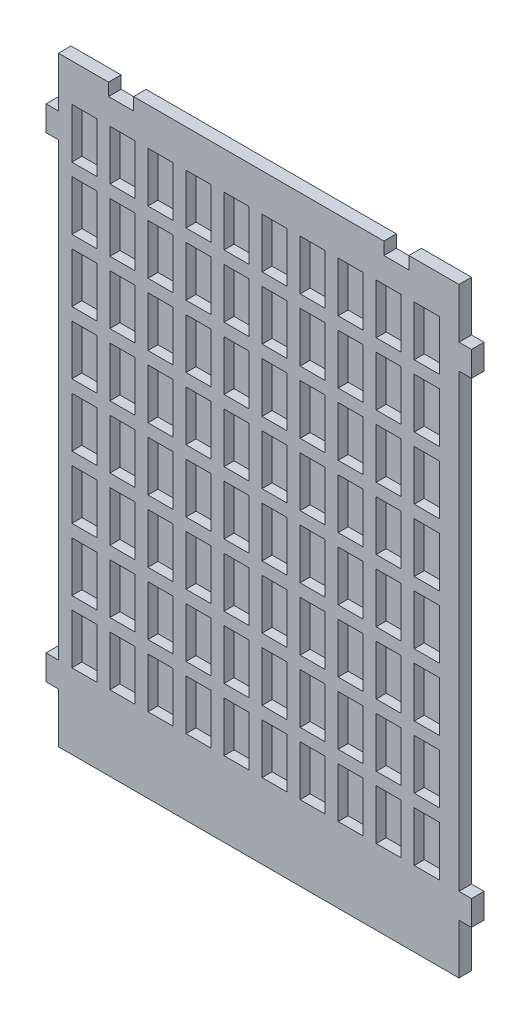
from build123d import *

# Parameters (mm, degrees)
BOSS_EXTRUDE1_DEPTH  = 3.175
SKETCH2_W            = 6.35
SKETCH2_H            = 12.7
CUT_EXTRUDE1_DEPTH   = 2.54
LPATTERN1_COUNT      = 10
LPATTERN1_PITCH      = 9.652
LPATTERN1_COUNT_DIR2 = 8
LPATTERN1_PITCH_DIR2 = 15.875


with BuildPart() as part:
    # Sketch1 → Boss-Extrude1 (new body)
    with BuildSketch(Plane.XY):
        Polygon((82.55, 0), (19.05, 0), (19.05, -3.175), (12.7, -3.175), (12.7, 0), (0, 0), (0, -12.7), (-3.175, -12.7), (-3.175, -19.05), (0, -19.05), (0, -133.35), (-3.175, -133.35), (-3.175, -139.7), (0, -139.7), (0, -152.4), (12.7, -152.4), (88.9, -152.4), (101.6, -152.4), (101.6, -139.7), (104.775, -139.7), (104.775, -133.35), (101.6, -133.35), (101.6, -19.05), (104.775, -19.05), (104.775, -12.7), (101.6, -12.7), (101.6, 0), (88.9, 0), (88.9, -3.175), (82.55, -3.175), align=None)
    extrude(amount=BOSS_EXTRUDE1_DEPTH)

    # Sketch2 → Cut-Extrude1 (cut)
    with BuildSketch(Plane.XY.offset(3.175)):
        with Locations((6.559374439, -15.875)):
            Rectangle(SKETCH2_W, SKETCH2_H)
    cut_extrude1 = extrude(amount=-CUT_EXTRUDE1_DEPTH, mode=Mode.SUBTRACT)

    # LPattern1: Cut-Extrude1 10 × 8
    with Locations(*[(i * LPATTERN1_PITCH, -j * LPATTERN1_PITCH_DIR2, 0) for i in range(LPATTERN1_COUNT) for j in range(LPATTERN1_COUNT_DIR2) if (i, j) != (0, 0)]):
        add(cut_extrude1, mode=Mode.SUBTRACT)


solid = part.part
